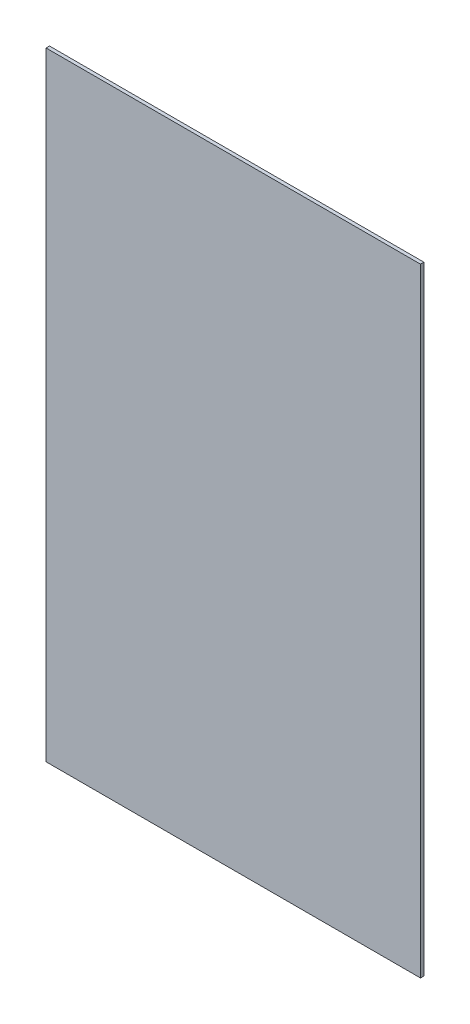
from build123d import *

# Parameters (mm, degrees)
SKETCH1_W           = 346.141930827
SKETCH1_H           = 571.5
BOSS_EXTRUDE1_DEPTH = 3.175


with BuildPart() as part:
    # Sketch1 → Boss-Extrude1 (new body)
    with BuildSketch(Plane.XY):
        with Locations((173.070965414, 285.75)):
            Rectangle(SKETCH1_W, SKETCH1_H)
    extrude(amount=BOSS_EXTRUDE1_DEPTH)


solid = part.part
